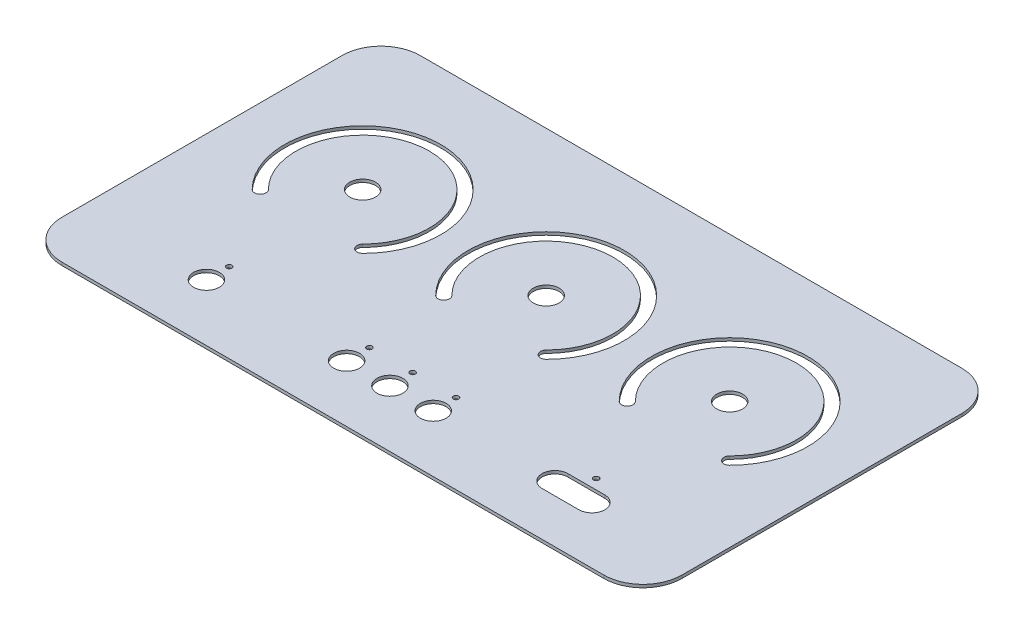
from build123d import *

# Parameters (mm, degrees)
SKETCH1_W           = 205.38
SKETCH1_H           = 118.65
SKETCH1_R           = 4.275
SKETCH1_R_2         = 0.89
BOSS_EXTRUDE1_DEPTH = 1
FILLET1_R           = 12.94


with BuildPart() as part:
    # Sketch1 → Boss-Extrude1 (new body)
    with BuildSketch(Plane(origin=(0, 0, 0), x_dir=(1, 0, 0), z_dir=(0, 1, 0))):
        Rectangle(SKETCH1_W, SKETCH1_H)
        with Locations(Location((0, -40.445, 0), (0, 0, 270))):
            Circle(SKETCH1_R, mode=Mode.SUBTRACT)
        with Locations(Location((-14.35, -40.445, 0), (0, 0, 270))):
            Circle(SKETCH1_R, mode=Mode.SUBTRACT)
        with Locations(Location((0, -32.895, 0), (0, 0, 270))):
            Circle(SKETCH1_R_2, mode=Mode.SUBTRACT)
        with Locations(Location((-14.35, -32.895, 0), (0, 0, 270))):
            Circle(SKETCH1_R_2, mode=Mode.SUBTRACT)
        with Locations(Location((0, 11.325, 0), (0, 0, 270))):
            Circle(SKETCH1_R, mode=Mode.SUBTRACT)
        with Locations(Location((-60.8, 11.325, 0), (0, 0, 270))):
            Circle(SKETCH1_R, mode=Mode.SUBTRACT)
        with Locations(Location((-60.8, -32.895, 0), (0, 0, 270))):
            Circle(SKETCH1_R_2, mode=Mode.SUBTRACT)
        with Locations(Location((14.35, -32.895, 0), (0, 0, 90))):
            Circle(SKETCH1_R_2, mode=Mode.SUBTRACT)
        with Locations(Location((14.35, -40.445, 0), (0, 0, 90))):
            Circle(SKETCH1_R, mode=Mode.SUBTRACT)
        with Locations(Location((60.8, -32.895, 0), (0, 0, 90))):
            Circle(SKETCH1_R_2, mode=Mode.SUBTRACT)
        with Locations(Location((60.8, 11.325, 0), (0, 0, 90))):
            Circle(SKETCH1_R, mode=Mode.SUBTRACT)
        with Locations(Location((-60.8, -40.445, 0), (0, 0, 270))):
            Circle(SKETCH1_R, mode=Mode.SUBTRACT)
        with BuildLine():
            Line((54.69, -36.17), (66.91, -36.17))
            ThreePointArc((66.91, -36.17), (71.185, -40.445), (66.91, -44.72))
            Line((66.91, -44.72), (54.69, -44.72))
            ThreePointArc((54.69, -44.72), (50.415, -40.445), (54.69, -36.17))
        make_face(mode=Mode.SUBTRACT)
        with BuildLine():
            ThreePointArc((18.306994565, -6.981994565), (0, 37.215), (-18.306994565, -6.981994565))
            ThreePointArc((-18.306994565, -6.981994565), (-15.627059864, -6.981994565), (-15.627059864, -4.302059864))
            ThreePointArc((-15.627059864, -4.302059864), (0, 33.425), (15.627059864, -4.302059864))
            ThreePointArc((15.627059864, -4.302059864), (15.627059864, -6.981994565), (18.306994565, -6.981994565))
        make_face(mode=Mode.SUBTRACT)
        with BuildLine():
            ThreePointArc((-42.493005435, -6.981994565), (-45.172940136, -6.981994565), (-45.172940136, -4.302059864))
            ThreePointArc((-45.172940136, -4.302059864), (-60.8, 33.425), (-76.427059864, -4.302059864))
            ThreePointArc((-76.427059864, -4.302059864), (-76.427059864, -6.981994565), (-79.106994565, -6.981994565))
            ThreePointArc((-79.106994565, -6.981994565), (-60.8, 37.215), (-42.493005435, -6.981994565))
        make_face(mode=Mode.SUBTRACT)
        with BuildLine():
            ThreePointArc((42.493005435, -6.981994565), (45.172940136, -6.981994565), (45.172940136, -4.302059864))
            ThreePointArc((45.172940136, -4.302059864), (60.8, 33.425), (76.427059864, -4.302059864))
            ThreePointArc((76.427059864, -4.302059864), (76.427059864, -6.981994565), (79.106994565, -6.981994565))
            ThreePointArc((79.106994565, -6.981994565), (60.8, 37.215), (42.493005435, -6.981994565))
        make_face(mode=Mode.SUBTRACT)
    extrude(amount=BOSS_EXTRUDE1_DEPTH)

    # Fillet1
    fillet1_edges = [part.edges().sort_by_distance(p)[0] for p in [
        (102.69, 0.5, 59.325),
        (-102.69, 0.5, 59.325),
        (-102.69, 0.5, -59.325),
        (102.69, 0.5, -59.325),
    ]]
    fillet(fillet1_edges, radius=FILLET1_R)


solid = part.part
